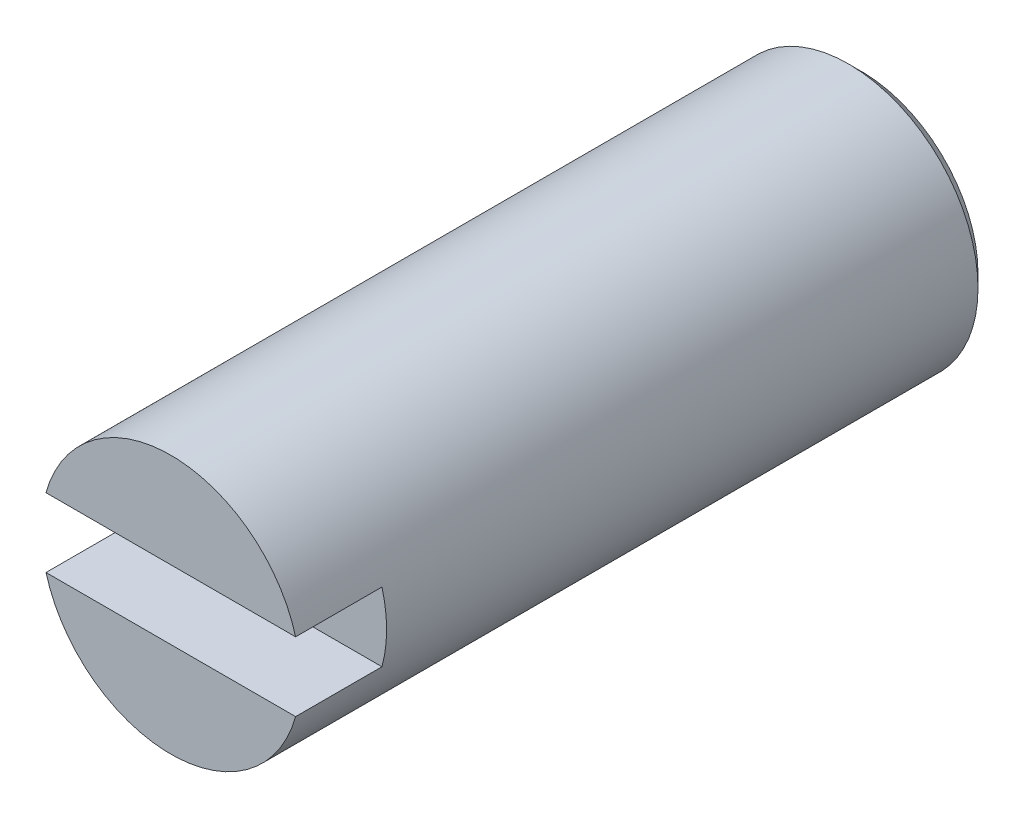
from build123d import *

# Parameters (mm, degrees)
SKETCH1_R           = 1.5
BOSS_EXTRUDE1_DEPTH = 4
CHAMFER1_SIZE       = 0.15
SKETCH3_W           = 3
SKETCH3_H           = 0.8
CUT_EXTRUDE1_DEPTH  = 1


with BuildPart() as part:
    # Sketch1 → Boss-Extrude1 (new, symmetric)
    with BuildSketch(Plane.XY):
        Circle(SKETCH1_R)
    extrude(amount=BOSS_EXTRUDE1_DEPTH, both=True)

    # Chamfer1
    chamfer1_edges = [part.edges().sort_by_distance(p)[0] for p in [
        (-1.5, 0, -4),
    ]]
    chamfer(chamfer1_edges, length=CHAMFER1_SIZE)

    # Sketch3 → Cut-Extrude1 (cut)
    with BuildSketch(Plane.XY.offset(4)):
        Rectangle(SKETCH3_W, SKETCH3_H)
    extrude(amount=-CUT_EXTRUDE1_DEPTH, mode=Mode.SUBTRACT)


solid = part.part
